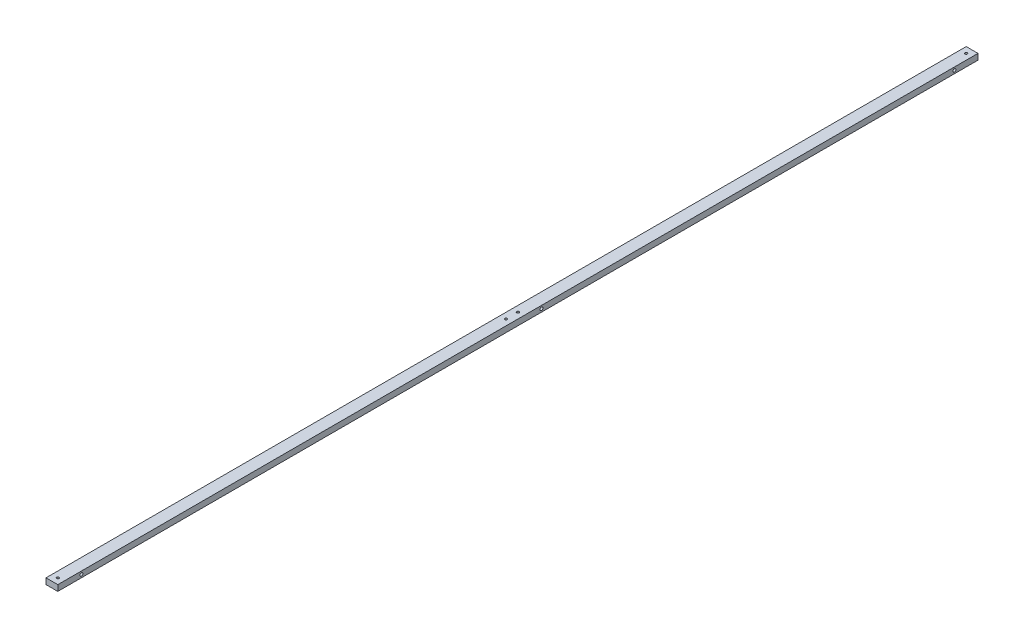
from build123d import *

# Parameters (mm, degrees)
SKETCH4_W                   = 25.4
SKETCH4_H                   = 12.7
BOSS_EXTRUDE2_DEPTH         = 1981.2
F_1_4_20_TAPPED_HOLE1_D     = 5.1054
F_1_4_0_25_DIAMETER_HOLE1_D = 6.35


with BuildPart() as part:
    # Sketch4 → Boss-Extrude2 (new body)
    with BuildSketch(Plane.XY):
        with Locations((12.7, 6.35)):
            Rectangle(SKETCH4_W, SKETCH4_H)
    extrude(amount=BOSS_EXTRUDE2_DEPTH)

    # 1/4-20 Tapped Hole1 (through all)
    with Locations(Plane(origin=(0, 12.7, 0), x_dir=(1, 0, 0), z_dir=(0, 1, 0))):
        with Locations((12.7, -1968.5), (12.7, -977.9), (12.7, -1003.3), (12.7, -12.7)):
            Hole(F_1_4_20_TAPPED_HOLE1_D / 2)

    # 1/4 (0.25) Diameter Hole1 (through all)
    with Locations(Plane(origin=(25.4, 0, 0), x_dir=(0, 0, -1), z_dir=(1, 0, 0))):
        with Locations((-50.8, 6.35), (-939.8, 6.35), (-1930.4, 6.35)):
            Hole(F_1_4_0_25_DIAMETER_HOLE1_D / 2)


solid = part.part
